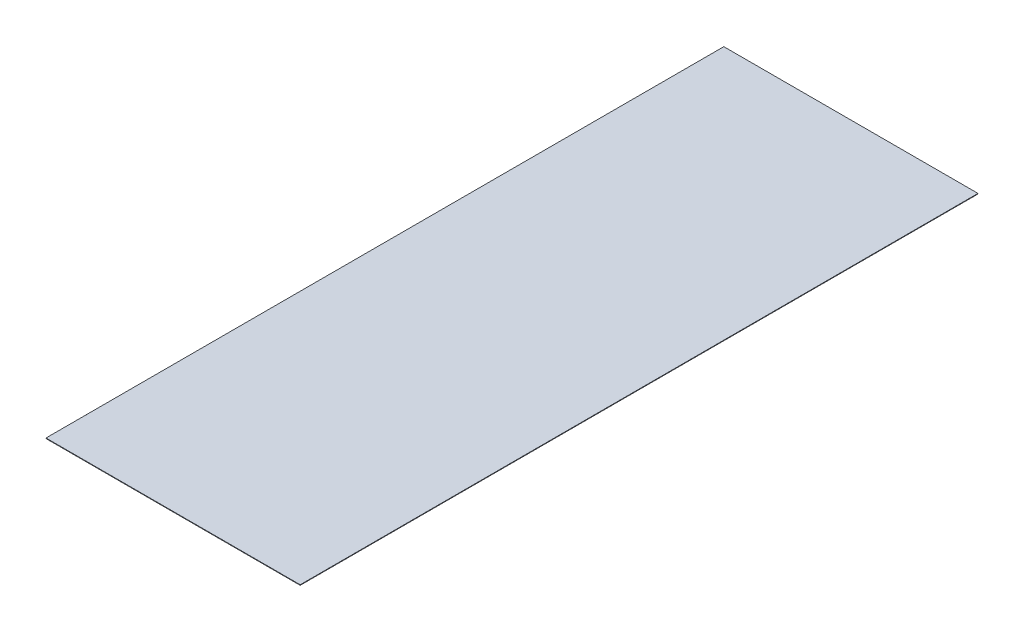
from build123d import *

# Parameters (mm, degrees)
CROQUIS1_W              = 914.4
CROQUIS1_H              = 2438.4
SALIENTE_EXTRUIR1_DEPTH = 1.9


with BuildPart() as part:
    # Croquis1 → Saliente-Extruir1 (new body)
    with BuildSketch(Plane(origin=(0, 0, 0), x_dir=(1, 0, 0), z_dir=(0, 1, 0))):
        Rectangle(CROQUIS1_W, CROQUIS1_H)
    extrude(amount=SALIENTE_EXTRUIR1_DEPTH)


solid = part.part
